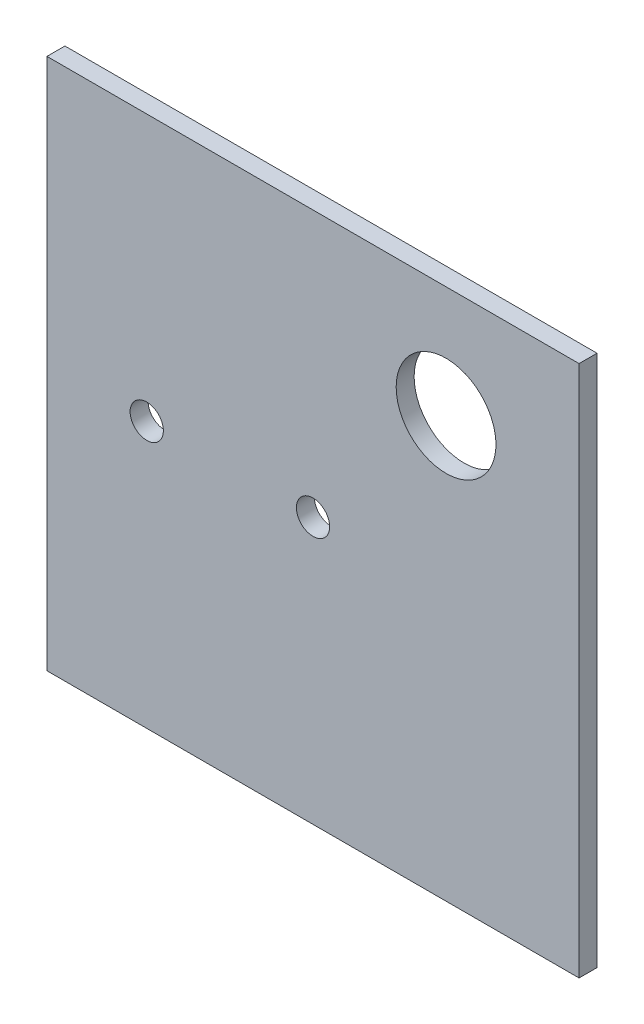
from build123d import *

# Parameters (mm, degrees)
CROQUIS1_W              = 80
CROQUIS1_H              = 80
SALIENTE_EXTRUIR2_DEPTH = 2.7
CROQUIS2_R              = 2.5
CORTAR_EXTRUIR1_DEPTH   = 2.7
CROQUIS4_R              = 7.5
CORTAR_EXTRUIR2_DEPTH   = 2.7


with BuildPart() as part:
    # Croquis1 → Saliente-Extruir2 (new body)
    with BuildSketch(Plane.XY):
        with Locations((-42.7, 0)):
            Rectangle(CROQUIS1_W, CROQUIS1_H)
    extrude(amount=-SALIENTE_EXTRUIR2_DEPTH)

    # Croquis2 → Cortar-Extruir1 (cut)
    with BuildSketch(Plane(origin=(0, 0, -2.7), x_dir=(-1, 0, 0), z_dir=(0, 0, -1))):
        with Locations((67.7, 0)):
            Circle(CROQUIS2_R)
        with Locations((42.7, 0)):
            Circle(CROQUIS2_R)
    extrude(amount=-CORTAR_EXTRUIR1_DEPTH, mode=Mode.SUBTRACT)

    # Croquis4 → Cortar-Extruir2 (cut)
    with BuildSketch(Plane(origin=(0, 0, -2.7), x_dir=(-1, 0, 0), z_dir=(0, 0, -1))):
        with Locations((22.7, 23.2)):
            Circle(CROQUIS4_R)
    extrude(amount=-CORTAR_EXTRUIR2_DEPTH, mode=Mode.SUBTRACT)


solid = part.part
